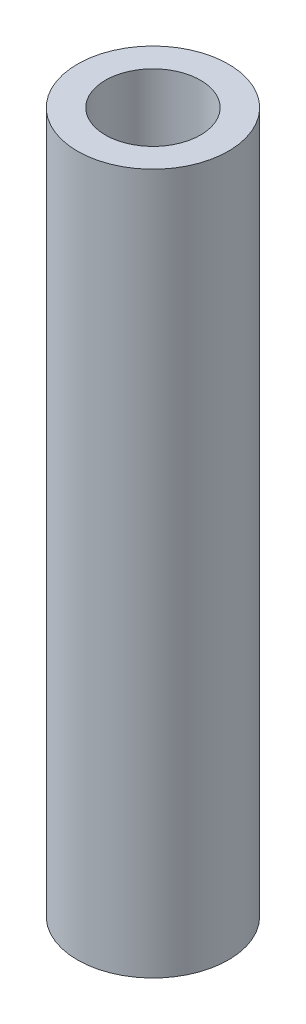
from build123d import *

# Parameters (mm, degrees)
SKETCH1_R           = 3.175
SKETCH1_R_2         = 2
BOSS_EXTRUDE1_DEPTH = 29.464


with BuildPart() as part:
    # Sketch1 → Boss-Extrude1 (new body)
    with BuildSketch(Plane(origin=(0, 0, 0), x_dir=(1, 0, 0), z_dir=(0, 1, 0))):
        with Locations(Location((0, 0, 0), (0, 0, 270))):
            Circle(SKETCH1_R)
        with Locations(Location((0, 0, 0), (0, 0, 270))):
            Circle(SKETCH1_R_2, mode=Mode.SUBTRACT)
    extrude(amount=-BOSS_EXTRUDE1_DEPTH)


solid = part.part
